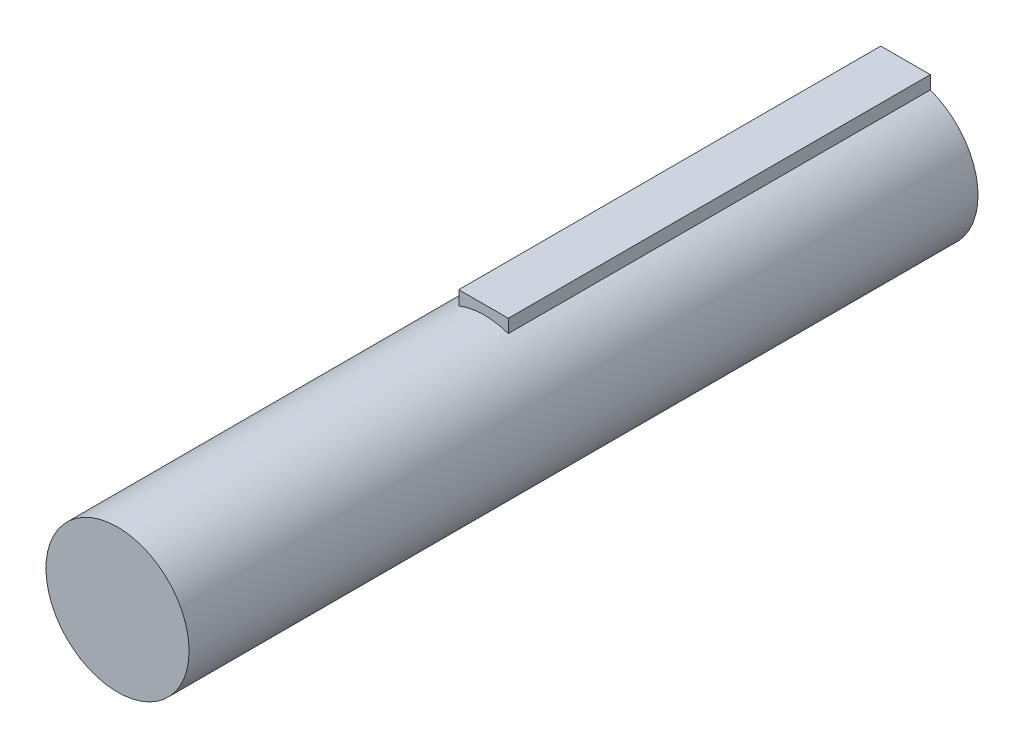
from build123d import *

# Parameters (mm, degrees)
EXTRUDE_1_DEPTH = 23
SKETCH_2_R      = 3.9
EXTRUDE_2_DEPTH = 20


with BuildPart() as part:
    # 草图1 → 凸台-拉伸1 (new body)
    with BuildSketch(Plane.XY):
        with BuildLine():
            Line((-1.4, 3.640054945), (-1.4, 4.4))
            Line((-1.4, 4.4), (1.3, 4.4))
            Line((1.3, 4.4), (1.3, 3.676955262))
            ThreePointArc((1.3, 3.676955262), (0.053295482, -3.899635828), (-1.4, 3.640054945))
        make_face()
    extrude(amount=EXTRUDE_1_DEPTH)

    # 草图2 → 凸台-拉伸2 (add)
    with BuildSketch(Plane.XY.offset(23)):
        with Locations(Location((0, 0, 0), (0, 0, 111.037221256))):
            Circle(SKETCH_2_R)
    extrude(amount=EXTRUDE_2_DEPTH)


solid = part.part
